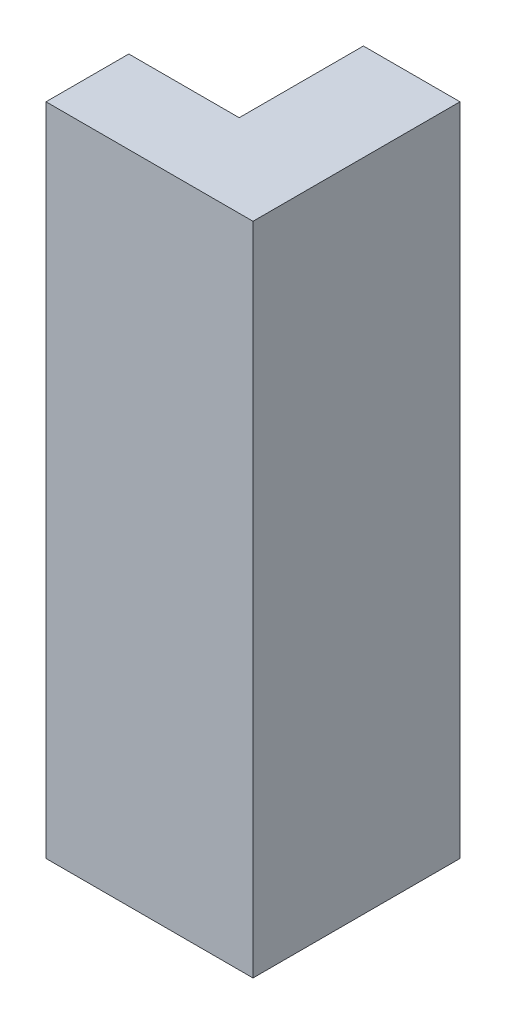
from build123d import *

# Parameters (mm, degrees)
BOSS_EXTRUDE1_DEPTH = 1187.25


with BuildPart() as part:
    # Sketch1 → Boss-Extrude1 (new body)
    with BuildSketch(Plane(origin=(0, 0, 0), x_dir=(1, 0, 0), z_dir=(0, 1, 0))):
        Polygon((-287.5, -187.5), (87.5, -187.5), (87.5, 187.5), (-87.5, 187.5), (-87.5, -37.5), (-287.5, -37.5), align=None)
    extrude(amount=BOSS_EXTRUDE1_DEPTH)


solid = part.part
